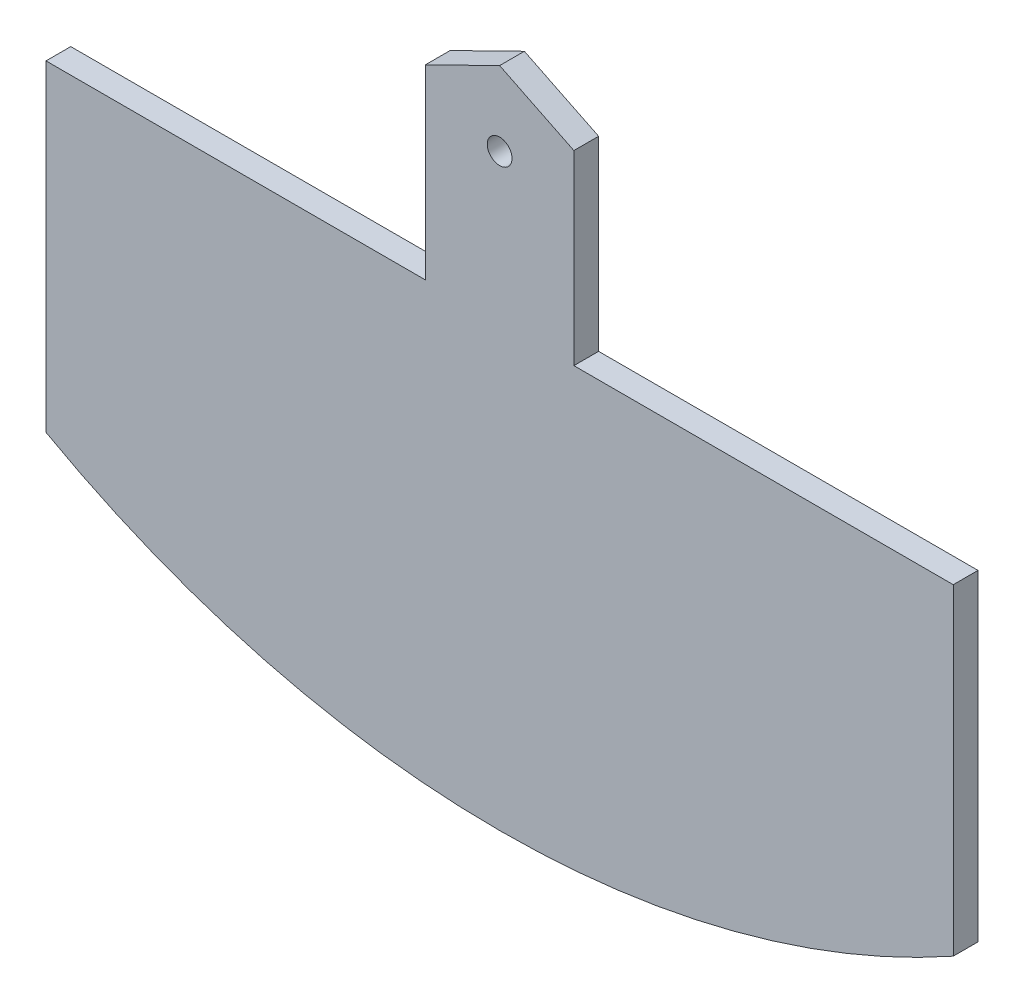
from build123d import *

# Parameters (mm, degrees)
P_IDAT_VYSUNUT_M1_DEPTH  = 5
SKICA2_R                 = 2.5
ODEBRAT_VYSUNUT_M1_DEPTH = 5
ODEBRAT_VYSUNUT_M2_DEPTH = 5
P_IDAT_VYSUNUT_M2_DEPTH  = 5


with BuildPart() as part:
    # Skica1 → Přidat vysunutím1 (new body)
    with BuildSketch(Plane.XY):
        Polygon((-91.646058289, -95), (91.646058289, -95), (91.646058289, -30), (0, 15), (-91.646058289, -30), align=None)
    extrude(amount=P_IDAT_VYSUNUT_M1_DEPTH)

    # Skica2 → Odebrat vysunutím1 (cut)
    with BuildSketch(Plane.XY.offset(5)):
        Circle(SKICA2_R)
    extrude(amount=-ODEBRAT_VYSUNUT_M1_DEPTH, mode=Mode.SUBTRACT)

    # Skica3 → Odebrat vysunutím2 (cut)
    with BuildSketch(Plane.XY.offset(5)):
        Polygon((91.646058289, -30), (15, -30), (15, 7.634707781), align=None)
        Polygon((-15, 7.634707781), (-91.646058289, -30), (-15, -30), align=None)
    extrude(amount=-ODEBRAT_VYSUNUT_M2_DEPTH, mode=Mode.SUBTRACT)

    # Skica4 → Přidat vysunutím2 (add)
    with BuildSketch(Plane.XY.offset(5)):
        with BuildLine():
            Line((-91.646058289, -95), (91.646058289, -95))
            ThreePointArc((91.646058289, -95), (0, -118.848037221), (-91.646058289, -95))
        make_face()
    extrude(amount=-P_IDAT_VYSUNUT_M2_DEPTH)


solid = part.part
